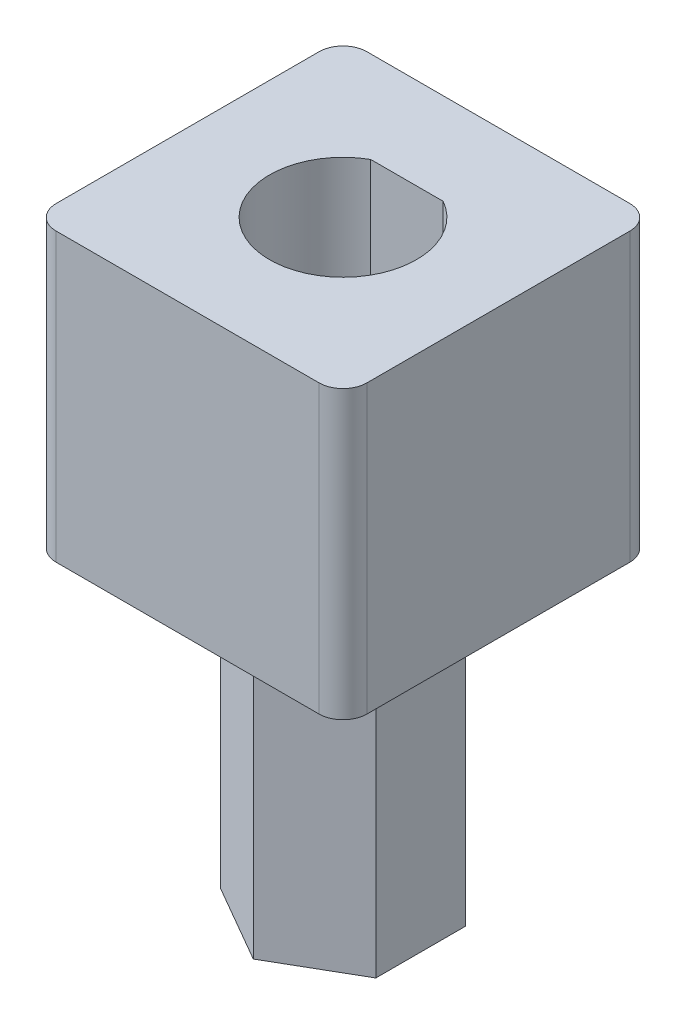
from build123d import *

# Parameters (mm, degrees)
SKETCH1_R           = 1.425
BOSS_EXTRUDE1_DEPTH = 13
SKETCH2_W           = 13
SKETCH2_H           = 13
SKETCH2_R           = 3.075
BOSS_EXTRUDE2_DEPTH = 12
BOSS_EXTRUDE3_REACH = 28.636
SKETCH5_R           = 1.425
CUT_EXTRUDE1_DEPTH  = 12
FILLET2_R           = 1


with BuildPart() as part:
    # Sketch1 → Boss-Extrude1 (new body)
    with BuildSketch(Plane(origin=(0, 0, 0), x_dir=(1, 0, 0), z_dir=(0, 1, 0))):
        Polygon((0, -3.75277675), (3.25, -1.876388375), (3.25, 1.876388375), (0, 3.75277675), (-3.25, 1.876388375), (-3.25, -1.876388375), align=None)
        with Locations(Location((0, 0, 0), (0, 0, 90))):
            Circle(SKETCH1_R, mode=Mode.SUBTRACT)
    extrude(amount=BOSS_EXTRUDE1_DEPTH)

    # Sketch2 → Boss-Extrude2 (add)
    with BuildSketch(Plane(origin=(0, 13, 0), x_dir=(1, 0, 0), z_dir=(0, 1, 0))):
        Rectangle(SKETCH2_W, SKETCH2_H)
        with Locations(Location((0, 0, 0), (0, 0, 270))):
            Circle(SKETCH2_R, mode=Mode.SUBTRACT)
    extrude(amount=BOSS_EXTRUDE2_DEPTH)

    # Sketch3 → Boss-Extrude3 (add, up to next)
    with BuildSketch(Plane(origin=(0, 25, 0), x_dir=(1, 0, 0), z_dir=(0, 1, 0)), mode=Mode.PRIVATE) as boss_extrude3_sk1:
        with BuildLine():
            Line((-1.516575089, 2.675), (1.516575089, 2.675))
            ThreePointArc((1.516575089, 2.675), (0, 3.075), (-1.516575089, 2.675))
        make_face()
    boss_extrude3_tool1 = extrude(boss_extrude3_sk1.sketch, amount=-BOSS_EXTRUDE3_REACH, mode=Mode.PRIVATE) - part.part
    add(boss_extrude3_tool1.solids().sort_by_distance((0, 25, -2.835927))[0])

    # Sketch5 → Cut-Extrude1 (cut)
    with BuildSketch(Plane.XY.offset(-2.675)):
        with Locations((0, 20)):
            Circle(SKETCH5_R)
    extrude(amount=-CUT_EXTRUDE1_DEPTH, mode=Mode.SUBTRACT)

    # Fillet2
    fillet2_edges = [part.edges().sort_by_distance(p)[0] for p in [
        (-6.5, 19, -6.5),
        (-6.5, 19, 6.5),
        (6.5, 19, 6.5),
        (6.5, 19, -6.5),
    ]]
    fillet(fillet2_edges, radius=FILLET2_R)

    # Sketch8 → Revolve1 (revolve)
    with BuildSketch(Plane(origin=(0, 0, 0), x_dir=(0, 0, -1), z_dir=(1, 0, 0))):
        Polygon((0, 13), (-3.75277675, 13), (-6.25277675, 13), (-3.75277675, 11), (0, 11), align=None)
    revolve(axis=Axis((0, -1000, 0), (0, 1, 0)))


solid = part.part
